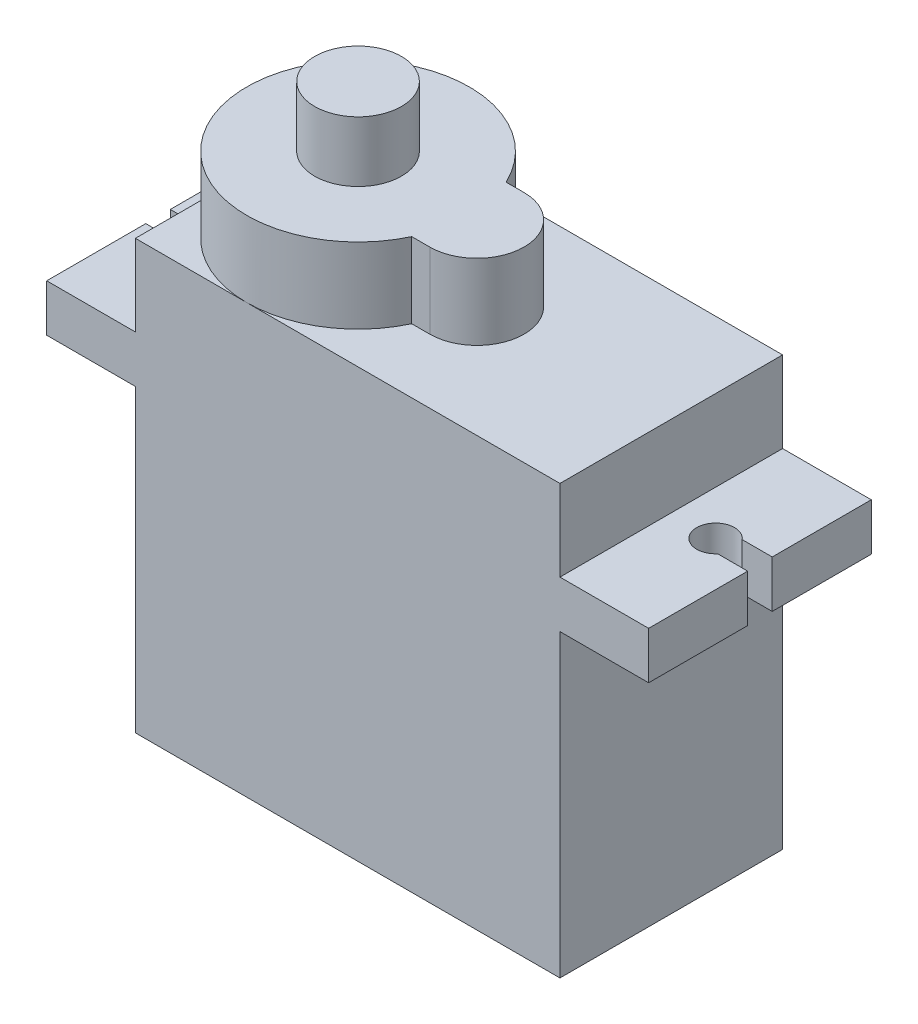
from build123d import *

# Parameters (mm, degrees)
BOSS_EXTRUDE1_DEPTH = 11.8
BOSS_EXTRUDE2_DEPTH = 4
SKETCH3_R           = 2.3
CUT_EXTRUDE1_DEPTH  = 4
CUT_EXTRUDE2_DEPTH  = 4
SKETCH5_R           = 2.3
BOSS_EXTRUDE3_DEPTH = 3.2


with BuildPart() as part:
    # Sketch1 → Boss-Extrude1 (new body)
    with BuildSketch(Plane.XY):
        Polygon((0, 0), (22.5, 0), (22.5, 15.9), (27.2, 15.9), (27.2, 18.4), (22.5, 18.4), (22.5, 22.7), (0, 22.7), (0, 18.4), (-4.7, 18.4), (-4.7, 15.9), (0, 15.9), align=None)
    extrude(amount=BOSS_EXTRUDE1_DEPTH)

    # Sketch2 → Boss-Extrude2 (add)
    with BuildSketch(Plane(origin=(0, 22.7, 0), x_dir=(1, 0, 0), z_dir=(0, 1, 0))):
        with BuildLine():
            Line((12.2, -3.4), (11.244155686, -3.4))
            ThreePointArc((11.244155686, -3.4), (0, -5.9), (11.244155686, -8.4))
            Line((11.244155686, -8.4), (12.2, -8.4))
            ThreePointArc((12.2, -8.4), (14.7, -5.9), (12.2, -3.4))
        make_face()
    extrude(amount=BOSS_EXTRUDE2_DEPTH)

    # Sketch3 → Cut-Extrude1 (cut)
    with BuildSketch(Plane(origin=(0, 26.7, 0), x_dir=(1, 0, 0), z_dir=(0, 1, 0))):
        with Locations(Location((5.9, -5.9, 0), (0, 0, 270))):
            Circle(SKETCH3_R)
    extrude(amount=-CUT_EXTRUDE1_DEPTH, mode=Mode.SUBTRACT)

    # Sketch4 → Cut-Extrude2 (cut)
    with BuildSketch(Plane(origin=(0, 18.4, 0), x_dir=(1, 0, 0), z_dir=(0, 1, 0))):
        with BuildLine():
            Line((-4.7, -5.25), (-4.7, -6.55))
            Line((-4.7, -6.55), (-3.109934208, -6.55))
            ThreePointArc((-3.109934208, -6.55), (-1.35, -5.9), (-3.109934208, -5.25))
            Line((-3.109934208, -5.25), (-4.7, -5.25))
        make_face()
    cut_extrude2 = extrude(amount=-CUT_EXTRUDE2_DEPTH, mode=Mode.SUBTRACT)

    # Mirror1: Cut-Extrude2 across plane
    add(cut_extrude2.mirror(Plane(origin=(11.25, 0, 0), x_dir=(0, 0, 1), z_dir=(1, 0, 0))), mode=Mode.SUBTRACT)


with BuildPart() as body_2:
    # Sketch5 → Boss-Extrude3 (new body)
    with BuildSketch(Plane(origin=(0, 26.7, 0), x_dir=(1, 0, 0), z_dir=(0, 1, 0))):
        with Locations(Location((5.9, -5.9, 0), (0, 0, 270))):
            Circle(SKETCH5_R)
    extrude(amount=BOSS_EXTRUDE3_DEPTH)


solid = Compound([part.part, body_2.part])
